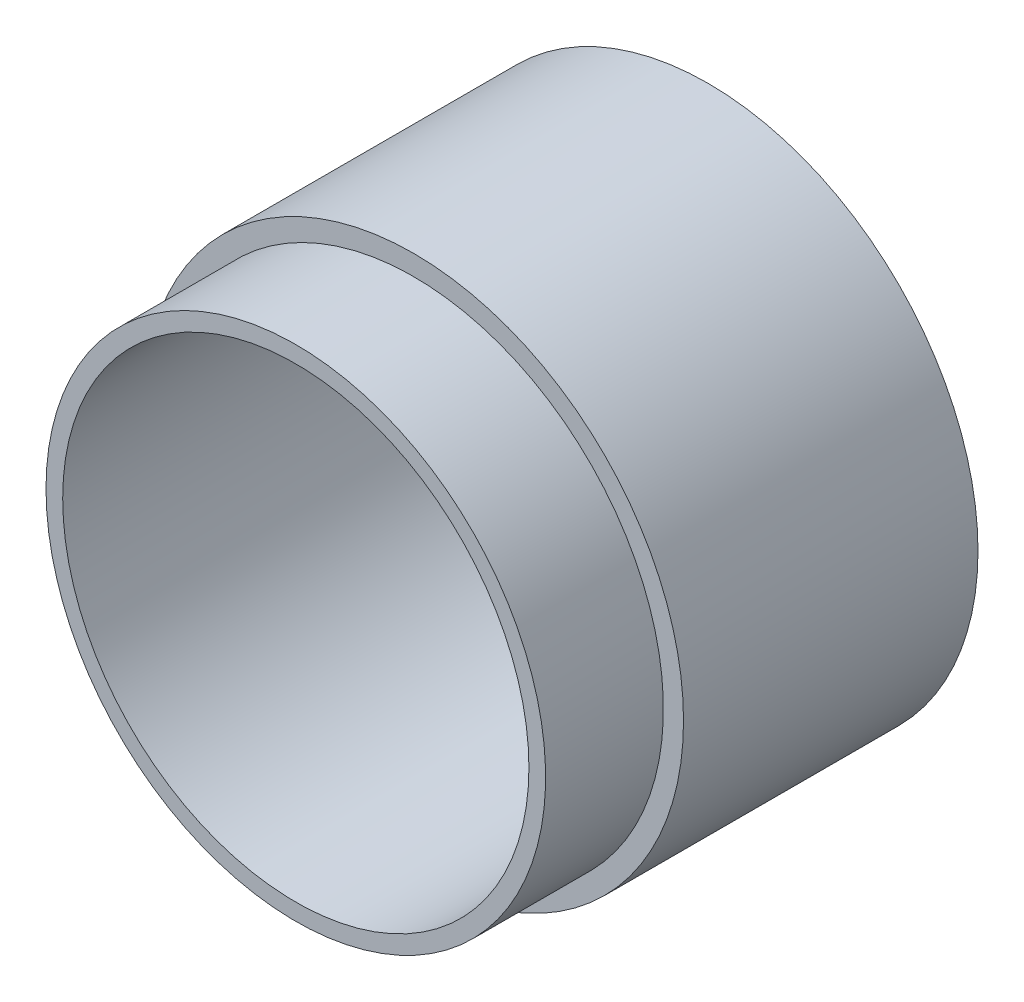
from build123d import *

# Parameters (mm, degrees)
SKETCH1_R           = 13.97
SKETCH1_R_2         = 12.065
BOSS_EXTRUDE1_DEPTH = 15.24
SKETCH2_R           = 13.97
SKETCH2_R_2         = 3.175
BOSS_EXTRUDE2_DEPTH = 1.27
SKETCH3_R           = 12.9286
SKETCH3_R_2         = 12.065
BOSS_EXTRUDE3_DEPTH = 6.096


with BuildPart() as part:
    # Sketch1 → Boss-Extrude1 (new body)
    with BuildSketch(Plane.XY):
        with Locations(Location((0, 0, 0), (0, 0, 180))):
            Circle(SKETCH1_R)
        with Locations(Location((0, 0, 0), (0, 0, 180))):
            Circle(SKETCH1_R_2, mode=Mode.SUBTRACT)
    extrude(amount=BOSS_EXTRUDE1_DEPTH)

    # Sketch2 → Boss-Extrude2 (add)
    with BuildSketch(Plane(origin=(0, 0, 0), x_dir=(-1, 0, 0), z_dir=(0, 0, -1))):
        Circle(SKETCH2_R)
        Circle(SKETCH2_R_2, mode=Mode.SUBTRACT)
    extrude(amount=-BOSS_EXTRUDE2_DEPTH)

    # Sketch3 → Boss-Extrude3 (add)
    with BuildSketch(Plane.XY.offset(15.24)):
        with Locations(Location((0, 0, 0), (0, 0, 180))):
            Circle(SKETCH3_R)
        with Locations(Location((0, 0, 0), (0, 0, 180))):
            Circle(SKETCH3_R_2, mode=Mode.SUBTRACT)
    extrude(amount=BOSS_EXTRUDE3_DEPTH)


solid = part.part
